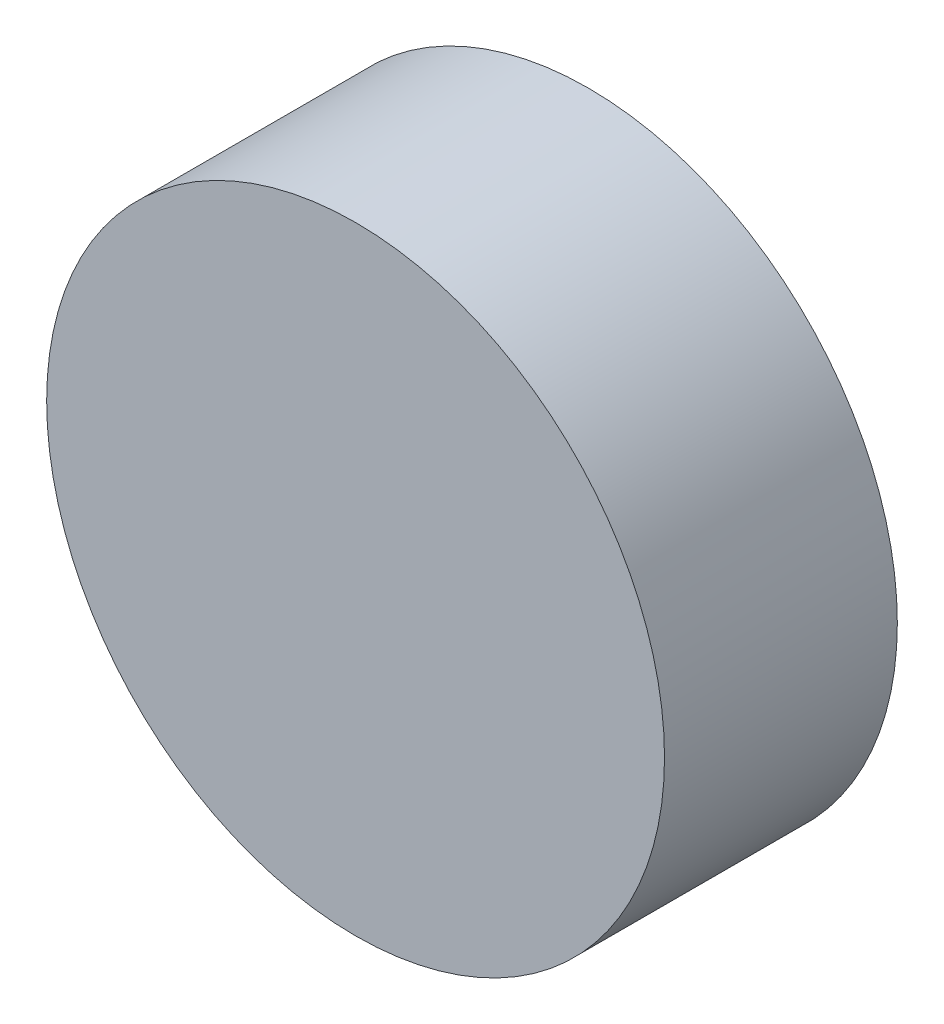
from build123d import *

# Parameters (mm, degrees)
SKETCH1_R           = 34.5
BOSS_EXTRUDE1_DEPTH = 26


with BuildPart() as part:
    # Sketch1 → Boss-Extrude1 (new body)
    with BuildSketch(Plane.XY):
        with Locations(Location((0, 0, 0), (0, 0, 180))):
            Circle(SKETCH1_R)
    extrude(amount=BOSS_EXTRUDE1_DEPTH)


solid = part.part
